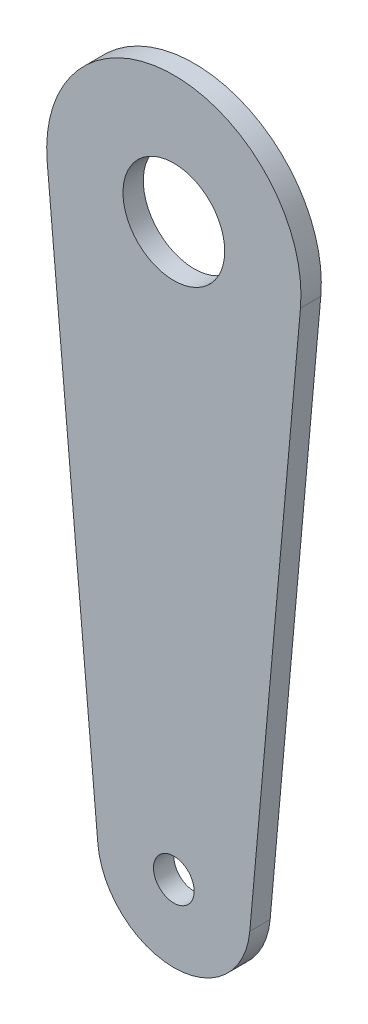
from build123d import *

# Parameters (mm, degrees)
CROQUIS1_R              = 4
CROQUIS1_R_2            = 10
SALIENTE_EXTRUIR1_DEPTH = 4


with BuildPart() as part:
    # Croquis1 → Saliente-Extruir1 (new body)
    with BuildSketch(Plane.XY):
        with BuildLine():
            Line((-24.90015137, 98.192857143), (-14.940090822, -12.914285714))
            ThreePointArc((-14.940090822, -12.914285714), (0, -26.575), (14.940090822, -12.914285714))
            Line((14.940090822, -12.914285714), (24.90015137, 98.192857143))
            ThreePointArc((24.90015137, 98.192857143), (0, 125.425), (-24.90015137, 98.192857143))
        make_face()
        with Locations((0, -11.575)):
            Circle(CROQUIS1_R, mode=Mode.SUBTRACT)
        with Locations((0, 100.425)):
            Circle(CROQUIS1_R_2, mode=Mode.SUBTRACT)
    extrude(amount=SALIENTE_EXTRUIR1_DEPTH)


solid = part.part
